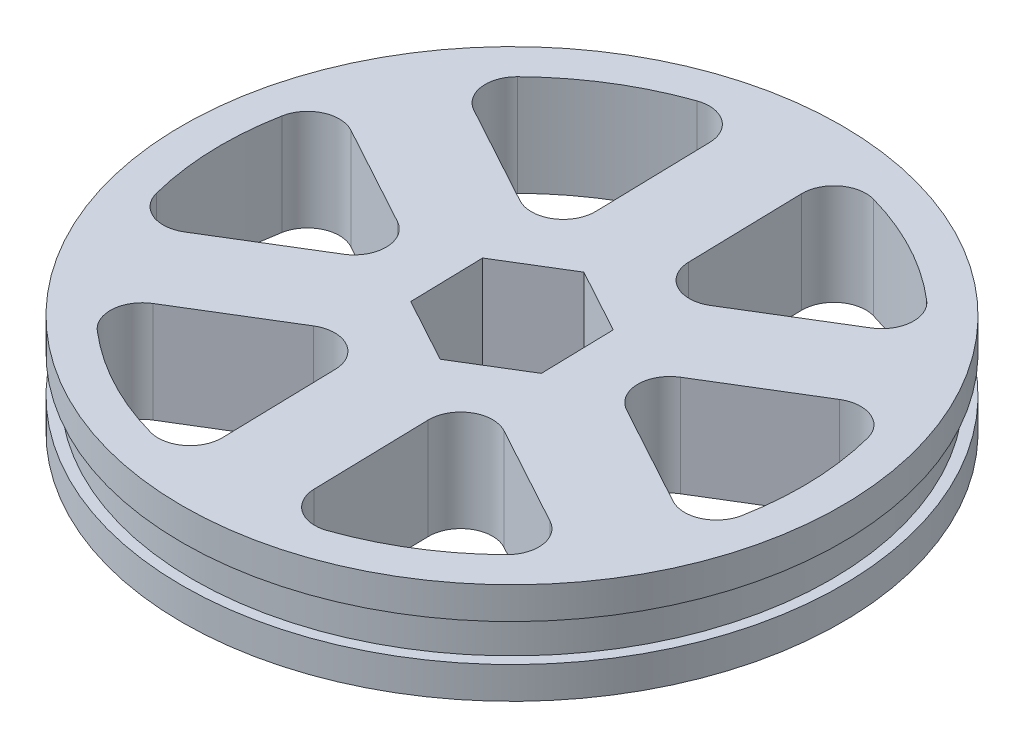
from build123d import *

# Parameters (mm, degrees)
SKETCH1_R                = 30
BOSS_EXTRUDE1_DEPTH      = 9.5
SKETCH1_4_R              = 31
SKETCH1_4_R_2            = 30
BOSS_EXTRUDE3_DEPTH      = 3
BOSS_EXTRUDE4_START      = -3
SKETCH4_R                = 31
BOSS_EXTRUDE4_DEPTH      = 3
CUT_EXTRUDE1_DEPTH       = 45.858109635
CUT_EXTRUDE2_DEPTH       = 45.858109635
FILLET1_R                = 3
CIRPATTERN1_COUNT        = 6
FILLET1_OF_CIRPATTERN1_R = 3


with BuildPart() as part:
    # Sketch1 → Boss-Extrude1 (new body)
    with BuildSketch(Plane(origin=(0, 0, 0), x_dir=(1, 0, 0), z_dir=(0, 1, 0))):
        Circle(SKETCH1_R)
    extrude(amount=BOSS_EXTRUDE1_DEPTH)

    # Sketch1<4> → Boss-Extrude3 (add)
    with BuildSketch(Plane(origin=(0, 0, 0), x_dir=(1, 0, 0), z_dir=(0, 1, 0))):
        Circle(SKETCH1_4_R)
        Circle(SKETCH1_4_R_2, mode=Mode.SUBTRACT)
    extrude(amount=BOSS_EXTRUDE3_DEPTH)

    # Sketch4 → Boss-Extrude4 (add)
    with BuildSketch(Plane(origin=(0, 9.5, 0), x_dir=(1, 0, 0), z_dir=(0, 1, 0)).offset(BOSS_EXTRUDE4_START)):
        Circle(SKETCH4_R)
    extrude(amount=BOSS_EXTRUDE4_DEPTH)

    # Sketch6 → Cut-Extrude1 (cut, through all)
    with BuildSketch(Plane(origin=(0, 9.5, 0), x_dir=(1, 0, 0), z_dir=(0, 1, 0))):
        Polygon((-6.082238944, 3.317584879), (-5.914232256, -3.608580998), (0.168006688, -6.926165877), (6.082238944, -3.317584879), (5.914232256, 3.608580998), (-0.168006688, 6.926165877), align=None)
    extrude(amount=-CUT_EXTRUDE1_DEPTH, mode=Mode.SUBTRACT)

    # Sketch7 → Cut-Extrude2 (cut, through all)
    with BuildSketch(Plane(origin=(0, 9.5, 0), x_dir=(1, 0, 0), z_dir=(0, 1, 0))):
        with BuildLine():
            Line((-4.427257323, 7.255990118), (-21.836731707, 16.752067056))
            ThreePointArc((-21.836731707, 16.752067056), (-14.339422173, 23.556707036), (-4.912250855, 27.250108785))
            Line((-4.912250855, 27.250108785), (-4.427257323, 7.255990118))
        make_face()
    cut_extrude2 = extrude(amount=-CUT_EXTRUDE2_DEPTH, mode=Mode.SUBTRACT)

    # Fillet1
    fillet1_edges = [part.edges().sort_by_distance(p)[0] for p in [
        (-4.427257323, 4.75, -7.255990118),
        (-4.912250855, 4.75, -27.250108785),
        (-21.836731707, 4.75, -16.752067056),
    ]]
    fillet(fillet1_edges, radius=FILLET1_R)

    # CirPattern1: Cut-Extrude2 ×6 about axis
    cirpattern1_axis = Axis((0, 9.5, 0), (0, 1, 0))
    for i in range(1, CIRPATTERN1_COUNT):
        add(cut_extrude2.rotate(cirpattern1_axis, i * 360 / CIRPATTERN1_COUNT), mode=Mode.SUBTRACT)

    # Fillet1 of CirPattern1
    fillet1_of_cirpattern1_edges = [part.edges().sort_by_distance(p)[0] for p in [
        (-8.497500434, 4.75, 0.206122251),
        (-26.055411892, 4.75, -9.370920362),
        (-25.42608149, 4.75, 10.535130867),
        (-4.070243111, 4.75, 7.46211237),
        (-21.143161036, 4.75, 17.879188423),
        (-3.589349782, 4.75, 27.287197922),
        (4.427257323, 4.75, 7.255990118),
        (4.912250855, 4.75, 27.250108785),
        (21.836731707, 4.75, 16.752067056),
        (8.497500434, 4.75, -0.206122251),
        (26.055411892, 4.75, 9.370920362),
        (25.42608149, 4.75, -10.535130867),
        (4.070243111, 4.75, -7.46211237),
        (21.143161036, 4.75, -17.879188423),
        (3.589349782, 4.75, -27.287197922),
    ]]
    fillet(fillet1_of_cirpattern1_edges, radius=FILLET1_OF_CIRPATTERN1_R)


solid = part.part
